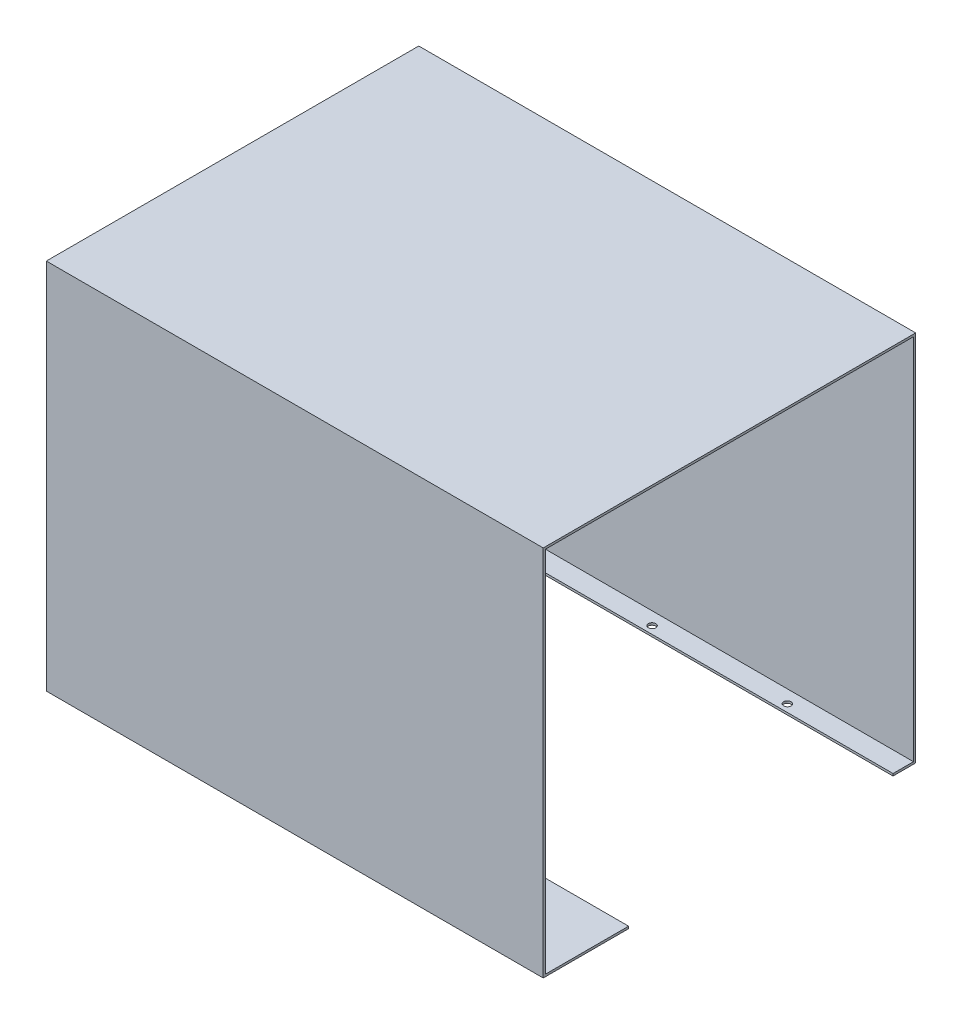
from build123d import *

# Parameters (mm, degrees)
CROQUIS1_W              = 428
CROQUIS1_H              = 317
SALIENTE_EXTRUIR1_DEPTH = 1.9
CROQUIS3_W              = 428
CROQUIS3_H              = 1.9
SALIENTE_EXTRUIR2_DEPTH = 320.8
CROQUIS4_W              = 428
CROQUIS4_H              = 1.9
SALIENTE_EXTRUIR3_DEPTH = 317
CROQUIS6_W              = 428
CROQUIS6_H              = 1.9
SALIENTE_EXTRUIR4_DEPTH = 19.52
CROQUIS7_W              = 428
CROQUIS7_H              = 1.9
SALIENTE_EXTRUIR5_DEPTH = 73.52
CROQUIS8_R              = 3.175
CORTAR_EXTRUIR1_DEPTH   = 1.9


with BuildPart() as part:
    # Croquis1 → Saliente-Extruir1 (new body)
    with BuildSketch(Plane.XY):
        with Locations((214, 158.5)):
            Rectangle(CROQUIS1_W, CROQUIS1_H)
    extrude(amount=SALIENTE_EXTRUIR1_DEPTH)

    # Croquis3 → Saliente-Extruir2 (add)
    with BuildSketch(Plane.XY.offset(1.9)):
        with Locations((214, 317.95)):
            Rectangle(CROQUIS3_W, CROQUIS3_H)
    extrude(amount=-SALIENTE_EXTRUIR2_DEPTH)

    # Croquis4 → Saliente-Extruir3 (add)
    with BuildSketch(Plane.XZ.offset(-317)):
        with Locations((214, -317.95)):
            Rectangle(CROQUIS4_W, CROQUIS4_H)
    extrude(amount=SALIENTE_EXTRUIR3_DEPTH)

    # Croquis6 → Saliente-Extruir4 (add)
    with BuildSketch(Plane(origin=(0, 0, -318.9), x_dir=(-1, 0, 0), z_dir=(0, 0, -1))):
        with Locations((-214, -0.95)):
            Rectangle(CROQUIS6_W, CROQUIS6_H)
    extrude(amount=-SALIENTE_EXTRUIR4_DEPTH)

    # Croquis7 → Saliente-Extruir5 (add)
    with BuildSketch(Plane.XY.offset(1.9)):
        with Locations((214, -0.95)):
            Rectangle(CROQUIS7_W, CROQUIS7_H)
    extrude(amount=-SALIENTE_EXTRUIR5_DEPTH)

    # Croquis8 → Cortar-Extruir1 (cut)
    with BuildSketch(Plane.XZ.offset(1.9)):
        with Locations(Location((214, -305.88, 0), (0, 0, 270))):
            Circle(CROQUIS8_R)
        with Locations(Location((330.5, -305.88, 0), (0, 0, 270))):
            Circle(CROQUIS8_R)
        with Locations(Location((97.5, -305.88, 0), (0, 0, 270))):
            Circle(CROQUIS8_R)
        with Locations(Location((97.5, -65.12, 0), (0, 0, 270))):
            Circle(CROQUIS8_R)
        with Locations(Location((330.5, -65.12, 0), (0, 0, 270))):
            Circle(CROQUIS8_R)
        with Locations(Location((214, -65.12, 0), (0, 0, 270))):
            Circle(CROQUIS8_R)
    extrude(amount=-CORTAR_EXTRUIR1_DEPTH, mode=Mode.SUBTRACT)


solid = part.part
